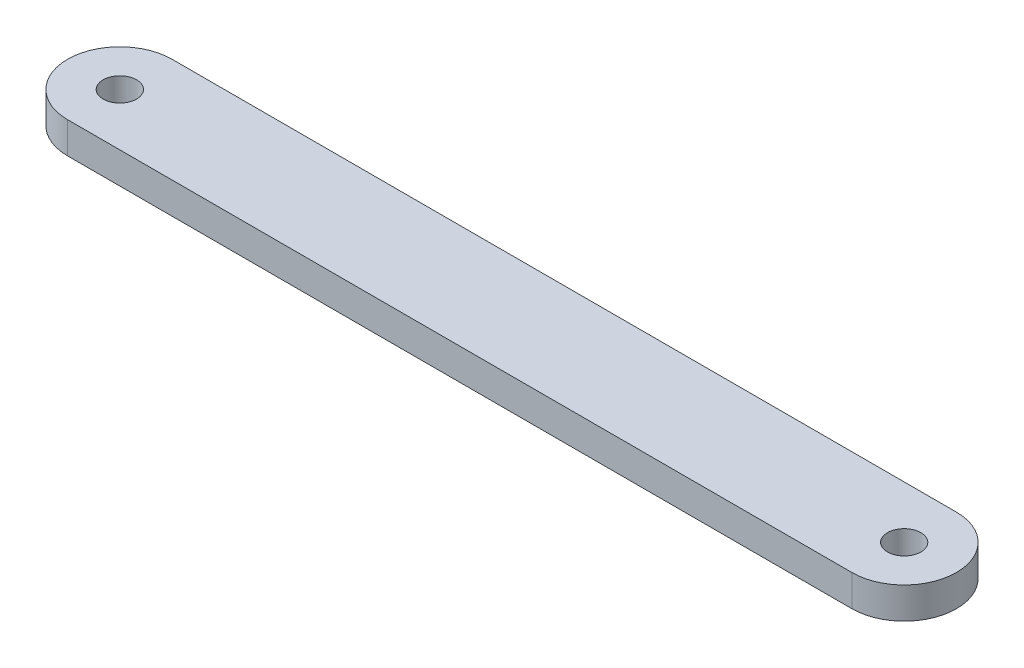
from build123d import *

# Parameters (mm, degrees)
SKETCH_1_R      = 1.6
EXTRUDE_1_DEPTH = 3


with BuildPart() as part:
    # ｽｹｯﾁ1 → ﾎﾞｽ - 押し出し1 (new body)
    with BuildSketch(Plane(origin=(0, 0, 0), x_dir=(1, 0, 0), z_dir=(0, 1, 0))):
        with BuildLine():
            Line((0, -5), (75, -5))
            ThreePointArc((75, -5), (80, 0), (75, 5))
            Line((75, 5), (0, 5))
            ThreePointArc((0, 5), (-5, 0), (0, -5))
        make_face()
        with Locations(Location((0, 0, 0), (0, 0, 270))):
            Circle(SKETCH_1_R, mode=Mode.SUBTRACT)
        with Locations(Location((75, 0, 0), (0, 0, 270))):
            Circle(SKETCH_1_R, mode=Mode.SUBTRACT)
    extrude(amount=EXTRUDE_1_DEPTH)


solid = part.part
